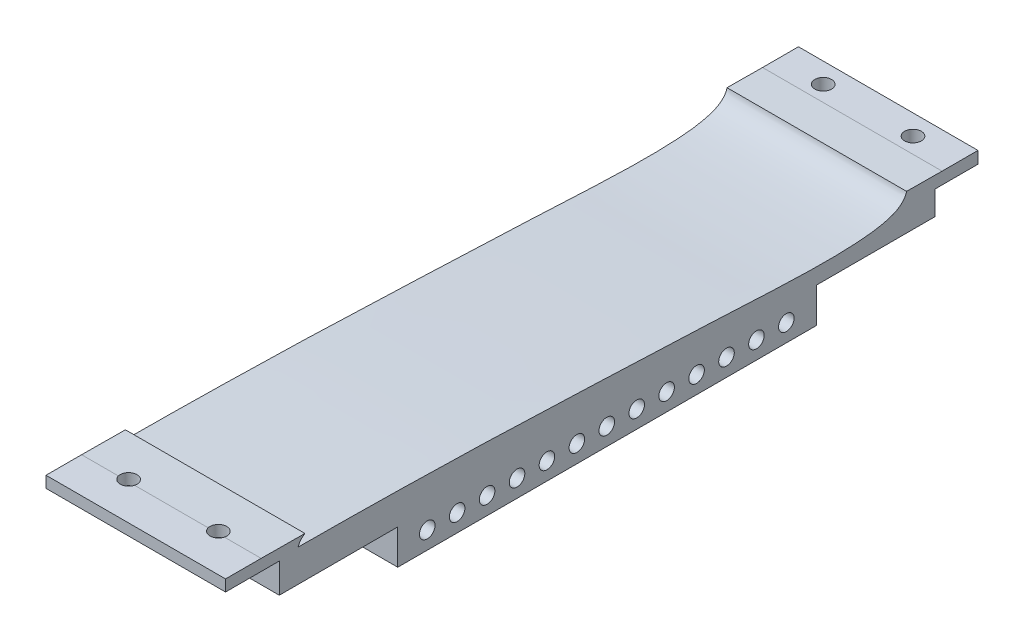
from build123d import *

# Parameters (mm, degrees)
BOSS_EXTRUDE1_DEPTH = 38.1
CUT_EXTRUDE1_START  = -3.62929
SKETCH3_R           = 1.778
CUT_EXTRUDE1_DEPTH  = 3.62929
SKETCH4_R           = 1.651
BOSS_EXTRUDE2_DEPTH = 38.1
CUT_EXTRUDE2_DEPTH  = 185.928


with BuildPart() as part:
    # Sketch1 → Boss-Extrude1 (new body)
    with BuildSketch(Plane(origin=(0, 0, 0), x_dir=(0, 0, -1), z_dir=(1, 0, 0))):
        with BuildLine():
            Line((72.215433049, -4.771977247), (79.835433049, -4.771977247))
            Line((79.835433049, -4.771977247), (79.835433049, -7.311977247))
            Line((79.835433049, -7.311977247), (70.738782801, -7.311977247))
            Line((70.738782801, -7.311977247), (70.738782801, -12.389567033))
            Line((70.738782801, -12.389567033), (-68.430564208, -12.389567033))
            Line((-68.430564208, -12.389567033), (-68.430564208, -6.099268824))
            Line((-68.430564208, -6.099268824), (-74.856371976, -6.099268824))
            Line((-74.856371976, -6.099268824), (-79.835433049, -6.099268824))
            Line((-79.835433049, -6.099268824), (-79.835433049, -3.682687087))
            Line((-79.835433049, -3.682687087), (-72.283197379, -3.682687087))
            Line((-72.283197379, -3.682687087), (-62.986438346, -3.752769884))
            ThreePointArc((-62.986438346, -3.752769884), (-63.870346675, -4.512898169), (-64.435010004, -5.532821827))
            add(Edge.make_bspline(
                [(64.675620781, -4.715139038), (64.674998783, -4.718415374), (64.674369605, -4.721689491), (64.640438814, -4.896142044), (64.587861308, -5.061634629), (64.449426441, -5.382802882), (64.363725162, -5.537307212), (64.17162642, -5.826785082), (64.064485069, -5.963468158), (63.83218052, -6.223745441), (63.706764404, -6.347347349), (63.31673426, -6.693304473), (63.035881098, -6.89512255), (62.439612226, -7.250945636), (62.122454544, -7.402893489), (61.480865859, -7.657691218), (61.153590873, -7.762859551), (60.16457344, -8.053692217), (59.494306502, -8.210115016), (58.137556276, -8.467333711), (57.45449622, -8.567109791), (56.090525333, -8.725352165), (55.407946102, -8.784190358), (53.359299354, -8.929652925), (51.992451836, -8.989633549), (49.257167888, -9.055319683), (47.888729178, -9.060947374), (45.150926584, -9.040600041), (43.781611648, -9.016297041), (41.042394842, -8.947642203), (39.672277986, -8.902131969), (36.933359378, -8.788840244), (35.564336613, -8.721422942), (32.8264286, -8.583195144), (31.457486551, -8.513786217), (28.719338408, -8.381483542), (27.350189587, -8.317176622), (23.242775683, -8.12345251), (20.504565285, -7.99268596), (15.027716298, -7.741718329), (12.289011598, -7.623148504), (6.810970928, -7.401585241), (4.071721736, -7.296450567), (-4.145694954, -6.97288207), (-9.623326908, -6.741233877), (-20.580851154, -6.333710524), (-26.06068615, -6.155413911), (-37.023140806, -5.871638351), (-42.504983165, -5.769502561), (-50.728224669, -5.647191595), (-53.469330363, -5.608049633), (-58.951944613, -5.555804239), (-61.693495206, -5.545373302), (-64.435010004, -5.532821827)],
                knots=[0.503868919, 0.503868919, 0.503868919, 0.503868919, 0.50390625, 0.50390625, 0.505859375, 0.505859375, 0.5078125, 0.5078125, 0.509765625, 0.509765625, 0.51171875, 0.51171875, 0.515625, 0.515625, 0.51953125, 0.51953125, 0.5234375, 0.5234375, 0.53125, 0.53125, 0.5390625, 0.5390625, 0.546875, 0.546875, 0.5625, 0.5625, 0.578125, 0.578125, 0.59375, 0.59375, 0.609375, 0.609375, 0.625, 0.625, 0.640625, 0.640625, 0.65625, 0.65625, 0.6875, 0.6875, 0.71875, 0.71875, 0.75, 0.75, 0.8125, 0.8125, 0.875, 0.875, 0.9375, 0.9375, 0.96875, 0.96875, 1, 1, 1, 1], degree=3))
            Line((64.675620781, -4.715139038), (72.215433049, -4.771977247))
        make_face()
    extrude(amount=BOSS_EXTRUDE1_DEPTH)

    # Sketch3 → Cut-Extrude1 (cut)
    with BuildSketch(Plane(origin=(0, -7.311977247, 0), x_dir=(-1, 0, 0), z_dir=(0, -1, 0)).offset(CUT_EXTRUDE1_START)):
        with Locations(Location((-9.525, -71.827406193, 0), (0, 0, 270))):
            Circle(SKETCH3_R)
        with Locations(Location((-28.575, -71.827406193, 0), (0, 0, 270))):
            Circle(SKETCH3_R)
        with Locations(Location((-28.575, 75.56507741, 0), (0, 0, 270))):
            Circle(SKETCH3_R)
        with Locations(Location((-9.525, 75.56507741, 0), (0, 0, 270))):
            Circle(SKETCH3_R)
    extrude(amount=CUT_EXTRUDE1_DEPTH, mode=Mode.SUBTRACT)

    # Sketch4 → Boss-Extrude2 (add)
    with BuildSketch(Plane.ZY):
        Polygon((-45.604109297, -19.812014108), (-45.604109297, -12.389567033), (-39.165535625, -12.389567033), (43.295890703, -12.389567033), (43.295890703, -19.812014108), align=None)
        with Locations((37.034464375, -16.072567033)):
            Circle(SKETCH4_R, mode=Mode.SUBTRACT)
        with Locations((30.684464375, -16.072567033)):
            Circle(SKETCH4_R, mode=Mode.SUBTRACT)
        with Locations((24.334464375, -16.072567033)):
            Circle(SKETCH4_R, mode=Mode.SUBTRACT)
        with Locations((17.984464375, -16.072567033)):
            Circle(SKETCH4_R, mode=Mode.SUBTRACT)
        with Locations((11.634464375, -16.072567033)):
            Circle(SKETCH4_R, mode=Mode.SUBTRACT)
        with Locations((5.284464375, -16.072567033)):
            Circle(SKETCH4_R, mode=Mode.SUBTRACT)
        with Locations((-1.065535625, -16.072567033)):
            Circle(SKETCH4_R, mode=Mode.SUBTRACT)
        with Locations((-7.415535625, -16.072567033)):
            Circle(SKETCH4_R, mode=Mode.SUBTRACT)
        with Locations((-13.765535625, -16.072567033)):
            Circle(SKETCH4_R, mode=Mode.SUBTRACT)
        with Locations((-20.115535625, -16.072567033)):
            Circle(SKETCH4_R, mode=Mode.SUBTRACT)
        with Locations((-26.465535625, -16.072567033)):
            Circle(SKETCH4_R, mode=Mode.SUBTRACT)
        with Locations((-32.815535625, -16.072567033)):
            Circle(SKETCH4_R, mode=Mode.SUBTRACT)
        with Locations((-39.165535625, -16.072567033)):
            Circle(SKETCH4_R, mode=Mode.SUBTRACT)
    extrude(amount=-BOSS_EXTRUDE2_DEPTH)

    # Sketch5 → Cut-Extrude2 (cut)
    with BuildSketch(Plane(origin=(0, 0, -79.835433049), x_dir=(-1, 0, 0), z_dir=(0, 0, -1))):
        Polygon((-19.05, -19.812014108), (-21.717, -19.812014108), (-21.717, -12.192014108), (-16.383, -12.192014108), (-16.383, -19.812014108), align=None)
    extrude(amount=-CUT_EXTRUDE2_DEPTH, mode=Mode.SUBTRACT)


solid = part.part
